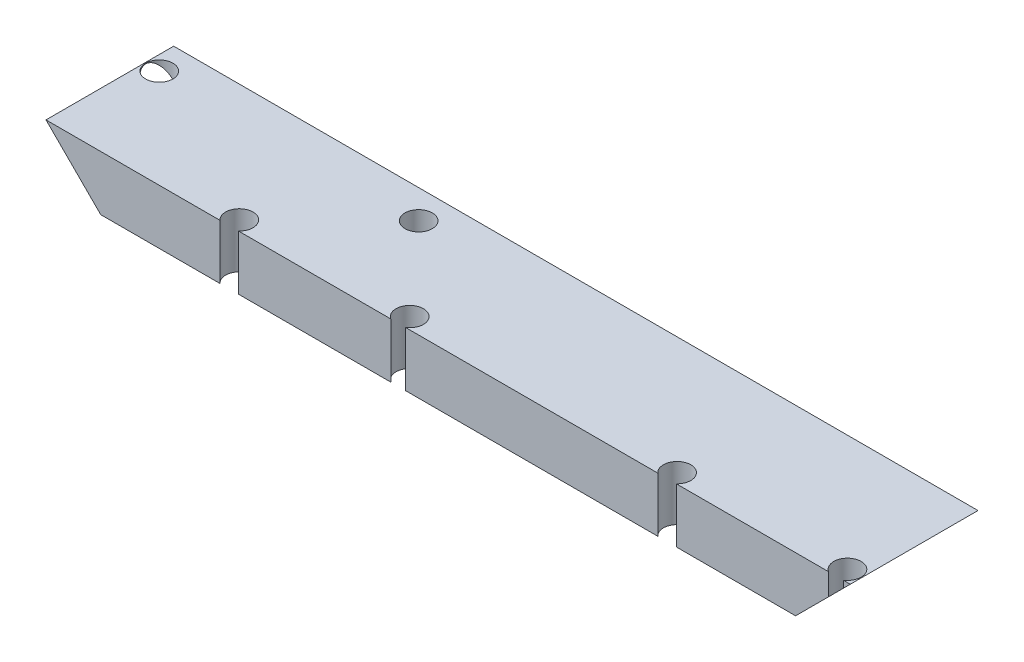
from build123d import *

# Parameters (mm, degrees)
SKETCH1_W                   = 560
SKETCH1_H                   = 88.9
BODY_DEPTH                  = 38.1
MOUNTING_HOLE_SPACING_REACH = 570.291
SKETCH2_R                   = 9.525
CUT_EXTRUDE1_REACH          = 570.291


with BuildPart() as part:
    # Sketch1 → Body (new body)
    with BuildSketch(Plane(origin=(0, 0, 0), x_dir=(1, 0, 0), z_dir=(0, 1, 0))):
        with Locations((280, 44.45)):
            Rectangle(SKETCH1_W, SKETCH1_H)
    extrude(amount=BODY_DEPTH)

    # Sketch2 → Mounting hole spacing (cut, up to next)
    with BuildSketch(Plane(origin=(0, 38.1, 0), x_dir=(1, 0, 0), z_dir=(0, 1, 0)), mode=Mode.PRIVATE) as mounting_hole_spacing_sk1:
        with Locations((127.6, 7)):
            Circle(SKETCH2_R)
    mounting_hole_spacing_tool1 = extrude(mounting_hole_spacing_sk1.sketch, amount=-MOUNTING_HOLE_SPACING_REACH, mode=Mode.PRIVATE) & part.part
    # Sketch2 → Mounting hole spacing (cut, up to next)
    with BuildSketch(Plane(origin=(0, 38.1, 0), x_dir=(1, 0, 0), z_dir=(0, 1, 0)), mode=Mode.PRIVATE) as mounting_hole_spacing_sk2:
        with Locations(Location((190.57, 68.87, 0), (0, 0, 270))):
            Circle(SKETCH2_R)
    mounting_hole_spacing_tool2 = extrude(mounting_hole_spacing_sk2.sketch, amount=-MOUNTING_HOLE_SPACING_REACH, mode=Mode.PRIVATE) & part.part
    # Sketch2 → Mounting hole spacing (cut, up to next)
    with BuildSketch(Plane(origin=(0, 38.1, 0), x_dir=(1, 0, 0), z_dir=(0, 1, 0)), mode=Mode.PRIVATE) as mounting_hole_spacing_sk3:
        with Locations(Location((10, 68.87, 0), (0, 0, 270))):
            Circle(SKETCH2_R)
    mounting_hole_spacing_tool3 = extrude(mounting_hole_spacing_sk3.sketch, amount=-MOUNTING_HOLE_SPACING_REACH, mode=Mode.PRIVATE) & part.part
    # Sketch2 → Mounting hole spacing (cut, up to next)
    with BuildSketch(Plane(origin=(0, 38.1, 0), x_dir=(1, 0, 0), z_dir=(0, 1, 0)), mode=Mode.PRIVATE) as mounting_hole_spacing_sk4:
        with Locations((245.2, 8.02)):
            Circle(SKETCH2_R)
    mounting_hole_spacing_tool4 = extrude(mounting_hole_spacing_sk4.sketch, amount=-MOUNTING_HOLE_SPACING_REACH, mode=Mode.PRIVATE) & part.part
    # Sketch2 → Mounting hole spacing (cut, up to next)
    with BuildSketch(Plane(origin=(0, 38.1, 0), x_dir=(1, 0, 0), z_dir=(0, 1, 0)), mode=Mode.PRIVATE) as mounting_hole_spacing_sk5:
        with Locations((550, 8.02)):
            Circle(SKETCH2_R)
    mounting_hole_spacing_tool5 = extrude(mounting_hole_spacing_sk5.sketch, amount=-MOUNTING_HOLE_SPACING_REACH, mode=Mode.PRIVATE) & part.part
    # Sketch2 → Mounting hole spacing (cut, up to next)
    with BuildSketch(Plane(origin=(0, 38.1, 0), x_dir=(1, 0, 0), z_dir=(0, 1, 0)), mode=Mode.PRIVATE) as mounting_hole_spacing_sk6:
        with Locations((432.4, 7)):
            Circle(SKETCH2_R)
    mounting_hole_spacing_tool6 = extrude(mounting_hole_spacing_sk6.sketch, amount=-MOUNTING_HOLE_SPACING_REACH, mode=Mode.PRIVATE) & part.part
    add(mounting_hole_spacing_tool1.solids().sort_by_distance((127.6, 38.1, -7))[0], mode=Mode.SUBTRACT)
    add(mounting_hole_spacing_tool2.solids().sort_by_distance((190.57, 38.1, -68.87))[0], mode=Mode.SUBTRACT)
    add(mounting_hole_spacing_tool3.solids().sort_by_distance((10, 38.1, -68.87))[0], mode=Mode.SUBTRACT)
    add(mounting_hole_spacing_tool4.solids().sort_by_distance((245.2, 38.1, -8.02))[0], mode=Mode.SUBTRACT)
    add(mounting_hole_spacing_tool5.solids().sort_by_distance((550, 38.1, -8.02))[0], mode=Mode.SUBTRACT)
    add(mounting_hole_spacing_tool6.solids().sort_by_distance((432.4, 38.1, -7))[0], mode=Mode.SUBTRACT)

    # Sketch3 → Cut-Extrude1 (cut, up to next)
    with BuildSketch(Plane(origin=(0, 0, -88.9), x_dir=(-1, 0, 0), z_dir=(0, 0, -1)), mode=Mode.PRIVATE) as cut_extrude1_sk1:
        Polygon((-560, 0), (-560, 38.1), (-521.9, 0), align=None)
    cut_extrude1_tool1 = extrude(cut_extrude1_sk1.sketch, amount=-CUT_EXTRUDE1_REACH, mode=Mode.PRIVATE) & part.part
    # Sketch3 → Cut-Extrude1 (cut, up to next)
    with BuildSketch(Plane(origin=(0, 0, -88.9), x_dir=(-1, 0, 0), z_dir=(0, 0, -1)), mode=Mode.PRIVATE) as cut_extrude1_sk2:
        Polygon((0, 0), (0, 38.1), (-38.1, 0), align=None)
    cut_extrude1_tool2 = extrude(cut_extrude1_sk2.sketch, amount=-CUT_EXTRUDE1_REACH, mode=Mode.PRIVATE) & part.part
    add(cut_extrude1_tool1.solids().sort_by_distance((547.3, 12.7, -88.9))[0], mode=Mode.SUBTRACT)
    add(cut_extrude1_tool2.solids().sort_by_distance((12.7, 12.7, -88.9))[0], mode=Mode.SUBTRACT)


solid = part.part
